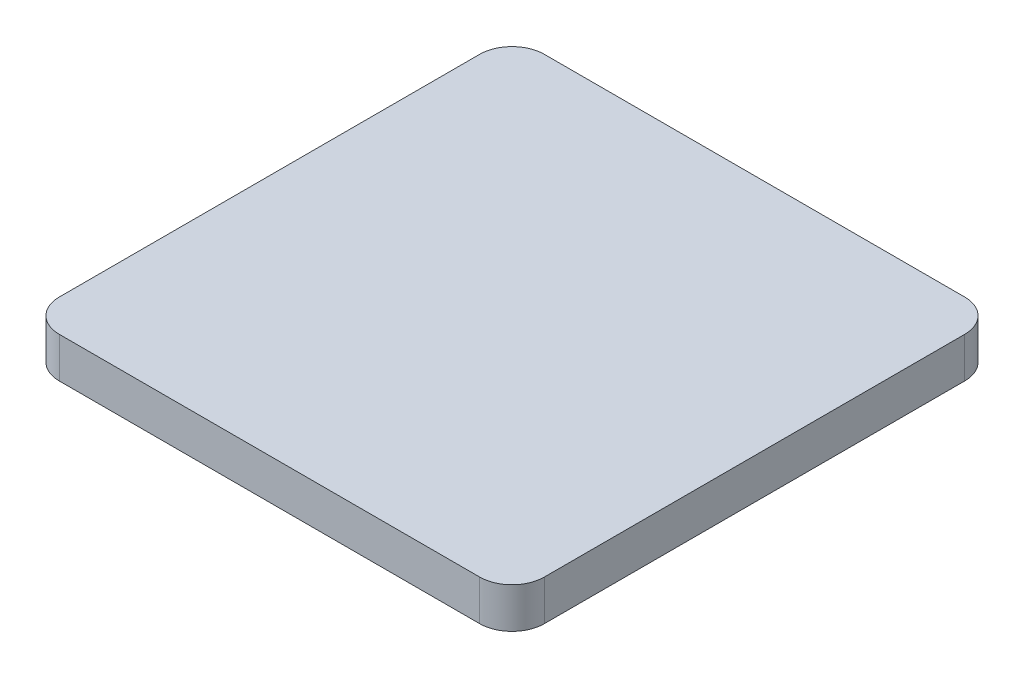
from build123d import *

# Parameters (mm, degrees)
SKETCH_1_W      = 120
SKETCH_1_H      = 120
EXTRUDE_1_DEPTH = 10
FILLET_1_R      = 8


with BuildPart() as part:
    # 草图1 → 凸台-拉伸1 (new body)
    with BuildSketch(Plane(origin=(0, 0, 0), x_dir=(1, 0, 0), z_dir=(0, 1, 0))):
        Rectangle(SKETCH_1_W, SKETCH_1_H)
    extrude(amount=EXTRUDE_1_DEPTH)

    # 圆角1
    fillet_1_edges = [part.edges().sort_by_distance(p)[0] for p in [
        (-60, 5, -60),
        (60, 5, -60),
        (60, 5, 60),
        (-60, 5, 60),
    ]]
    fillet(fillet_1_edges, radius=FILLET_1_R)


solid = part.part
